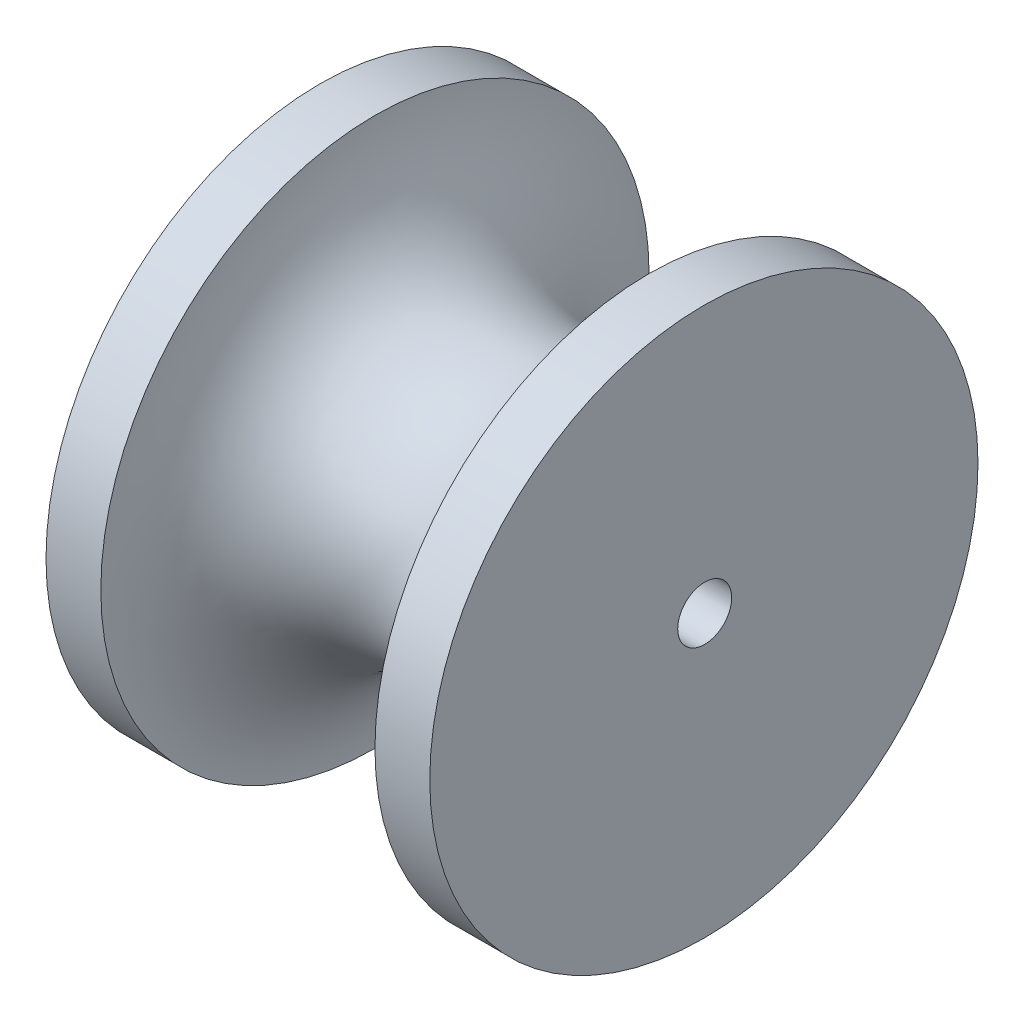
from build123d import *

# Parameters (mm, degrees)
F_97_0_0059_DIAMETER_HOLE2_D = 0.14986
SKETCH5_R                    = 2.5
CUT_EXTRUDE2_DEPTH           = 35.56


with BuildPart() as part:
    # Sketch1 → Revolve1 (revolve)
    with BuildSketch(Plane.XY, mode=Mode.PRIVATE) as revolve1_sk:
        with BuildLine():
            Line((-55.768127135, -1.934587814), (-50.688127135, -1.934587814))
            ThreePointArc((-50.688127135, -1.934587814), (-37.988127135, -14.634587814), (-25.288127135, -1.934587814))
            Line((-25.288127135, -1.934587814), (-20.208127135, -1.934587814))
            Line((-20.208127135, -1.934587814), (-20.208127135, -27.334587814))
            Line((-20.208127135, -27.334587814), (-55.768127135, -27.334587814))
            Line((-55.768127135, -27.334587814), (-55.768127135, -1.934587814))
        make_face()
    revolve(revolve1_sk.sketch.rotate(Axis((-55.768127135, -27.334587814, 0), (1, 0, 0)), 90), axis=Axis((-55.768127135, -27.334587814, 0), (1, 0, 0)))

    # #97 (0.0059) Diameter Hole2 (through all)
    with Locations(Plane.ZY.offset(55.768127135)):
        with Locations((0, -26.686562296)):
            Hole(F_97_0_0059_DIAMETER_HOLE2_D / 2)

    # Sketch5 → Cut-Extrude2 (cut)
    with BuildSketch(Plane.ZY.offset(55.768127135)):
        with Locations((-0.07493, -26.686562296)):
            Circle(SKETCH5_R)
    extrude(amount=-CUT_EXTRUDE2_DEPTH, mode=Mode.SUBTRACT)


solid = part.part
